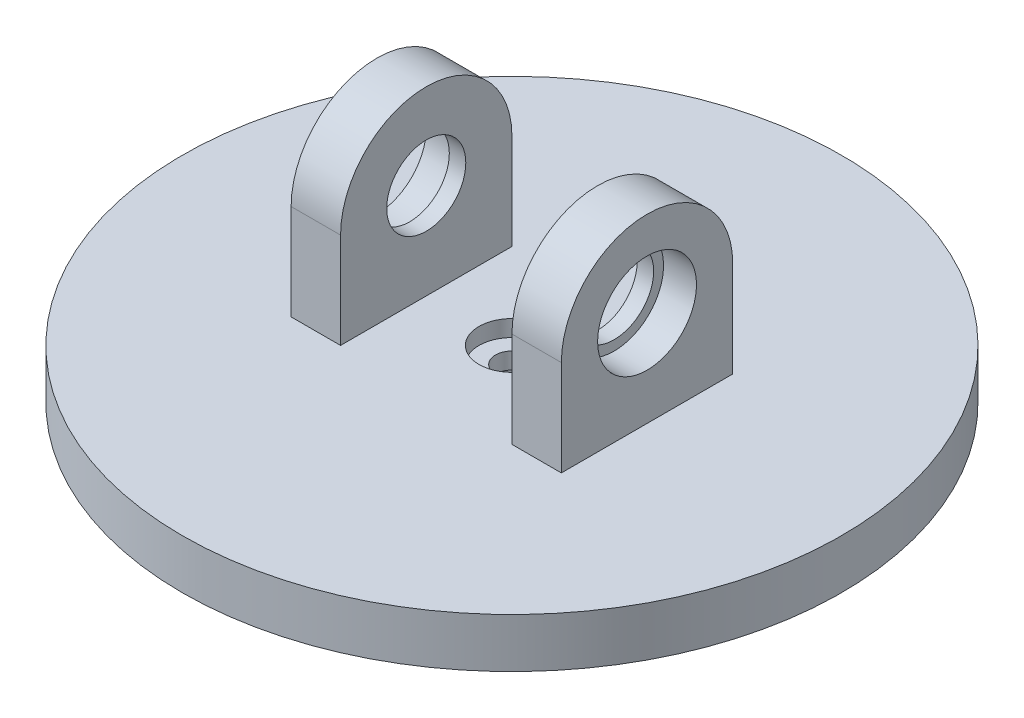
from build123d import *

# Parameters (mm, degrees)
SKIZZE1_R                        = 100
AUFSATZ_LINEAR_AUSTRAGEN1_DEPTH  = 15
AUFSATZ_LINEAR_AUSTRAGEN2_DEPTH  = 55
SCHNITT_LINEAR_AUSTRAGEN5_REACH  = 188.497
SKIZZE7_R                        = 15
SCHNITT_LINEAR_AUSTRAGEN6_DEPTH  = 10
SKIZZE10_R                       = 10
SCHNITT_LINEAR_AUSTRAGEN9_DEPTH  = 5
SCHNITT_LINEAR_START             = -5
SKIZZE11_R                       = 10
SCHNITT_LINEAR_AUSTRAGEN10_DEPTH = 5
SKIZZE12_R                       = 90
SKIZZE12_R_2                     = 84
SCHNITT_LINEAR_AUSTRAGEN11_DEPTH = 2.8
SKIZZE13_R                       = 5
SCHNITT_LINEAR_AUSTRAGEN12_DEPTH = 5
SKIZZE14_R                       = 12
SCHNITT_LINEAR_AUSTRAGEN13_DEPTH = 10


with BuildPart() as part:
    # Skizze1 → Aufsatz-Linear austragen1 (new body)
    with BuildSketch(Plane(origin=(0, 0, 0), x_dir=(1, 0, 0), z_dir=(0, 1, 0))):
        with Locations(Location((0, 0, 0), (0, 0, 270))):
            Circle(SKIZZE1_R)
    extrude(amount=AUFSATZ_LINEAR_AUSTRAGEN1_DEPTH)

    # Skizze2 → Aufsatz-Linear austragen2 (add)
    with BuildSketch(Plane(origin=(0, 15, 0), x_dir=(1, 0, 0), z_dir=(0, 1, 0))):
        Polygon((-26, -25), (-26, 25), (-26, 26), (-41, 26), (-41, -26), (-26, -26), align=None)
        Polygon((26, 26), (26, 25), (26, -25), (26, -26), (41, -26), (41, 26), align=None)
    extrude(amount=AUFSATZ_LINEAR_AUSTRAGEN2_DEPTH)

    # Schnitt-Linear austragen5: up to this face of the body (flat: up to its plane)
    schnitt_linear_austragen5_end = Plane(part.part.faces().sort_by_distance((41, 42.5, 0))[0])
    # Skizze3 → Schnitt-Linear austragen5 (cut, up to the picked face)
    with BuildSketch(Plane.ZY.offset(41), mode=Mode.PRIVATE) as schnitt_linear_austragen5_sk1:
        with BuildLine():
            Line((-26, 70), (-26, 44))
            ThreePointArc((-26, 44), (-18.384776279, 62.384776343), (9.1e-08, 70))
            Line((9.1e-08, 70), (-26, 70))
        make_face()
    schnitt_linear_austragen5_tool1 = split(extrude(schnitt_linear_austragen5_sk1.sketch, amount=-SCHNITT_LINEAR_AUSTRAGEN5_REACH, mode=Mode.PRIVATE), bisect_by=schnitt_linear_austragen5_end, keep=Keep.BOTH, mode=Mode.PRIVATE)
    # Skizze3 → Schnitt-Linear austragen5 (cut, up to the picked face)
    with BuildSketch(Plane.ZY.offset(41), mode=Mode.PRIVATE) as schnitt_linear_austragen5_sk2:
        with BuildLine():
            ThreePointArc((9.1e-08, 70), (18.384776343, 62.384776279), (26, 44))
            Line((26, 44), (26, 70))
            Line((26, 70), (9.1e-08, 70))
        make_face()
    schnitt_linear_austragen5_tool2 = split(extrude(schnitt_linear_austragen5_sk2.sketch, amount=-SCHNITT_LINEAR_AUSTRAGEN5_REACH, mode=Mode.PRIVATE), bisect_by=schnitt_linear_austragen5_end, keep=Keep.BOTH, mode=Mode.PRIVATE)
    add(schnitt_linear_austragen5_tool1.solids().sort_by(Axis((-41, 64.192434, -20.192434), (1, 0, 0)))[0], mode=Mode.SUBTRACT)
    add(schnitt_linear_austragen5_tool2.solids().sort_by(Axis((-41, 64.192434, 20.192434), (1, 0, 0)))[0], mode=Mode.SUBTRACT)

    # Skizze7 → Schnitt-Linear austragen6 (cut)
    with BuildSketch(Plane.ZY.offset(41)):
        with Locations((0, 44)):
            Circle(SKIZZE7_R)
    schnitt_linear_austragen6 = extrude(amount=-SCHNITT_LINEAR_AUSTRAGEN6_DEPTH, mode=Mode.SUBTRACT)

    # Skizze10 → Schnitt-Linear austragen9 (cut)
    with BuildSketch(Plane(origin=(0, 15, 0), x_dir=(1, 0, 0), z_dir=(0, 1, 0))):
        with Locations(Location((0, 0, 0), (0, 0, 270))):
            Circle(SKIZZE10_R)
    extrude(amount=-SCHNITT_LINEAR_AUSTRAGEN9_DEPTH, mode=Mode.SUBTRACT)

    # Skizze11 → Schnitt-Linear austragen10 (cut)
    with BuildSketch(Plane.XZ.offset(SCHNITT_LINEAR_START)):
        with Locations(Location((0, 0, 0), (0, 0, 90))):
            Circle(SKIZZE11_R)
    extrude(amount=SCHNITT_LINEAR_AUSTRAGEN10_DEPTH, mode=Mode.SUBTRACT)

    # Skizze12 → Schnitt-Linear austragen11 (cut)
    with BuildSketch(Plane.XZ):
        with Locations(Location((0, 0, 0), (0, 0, 270))):
            Circle(SKIZZE12_R)
        with Locations(Location((0, 0, 0), (0, 0, 270))):
            Circle(SKIZZE12_R_2, mode=Mode.SUBTRACT)
    extrude(amount=-SCHNITT_LINEAR_AUSTRAGEN11_DEPTH, mode=Mode.SUBTRACT)

    # Skizze13 → Schnitt-Linear austragen12 (cut)
    with BuildSketch(Plane.XZ.offset(-5)):
        with Locations(Location((0, 0, 0), (0, 0, 270))):
            Circle(SKIZZE13_R)
    extrude(amount=-SCHNITT_LINEAR_AUSTRAGEN12_DEPTH, mode=Mode.SUBTRACT)

    # Skizze14 → Schnitt-Linear austragen13 (cut)
    with BuildSketch(Plane(origin=(-26, 0, 0), x_dir=(0, 0, -1), z_dir=(1, 0, 0))):
        with Locations((0, 44)):
            Circle(SKIZZE14_R)
    schnitt_linear_austragen13 = extrude(amount=-SCHNITT_LINEAR_AUSTRAGEN13_DEPTH, mode=Mode.SUBTRACT)

    # Spiegeln1: Schnitt-Linear austragen6, Schnitt-Linear austragen13 across plane
    add(schnitt_linear_austragen6.mirror(Plane(origin=(0, 0, 0), x_dir=(0, 0, 1), z_dir=(1, 0, 0))), mode=Mode.SUBTRACT)
    add(schnitt_linear_austragen13.mirror(Plane(origin=(0, 0, 0), x_dir=(0, 0, 1), z_dir=(1, 0, 0))), mode=Mode.SUBTRACT)


solid = part.part
